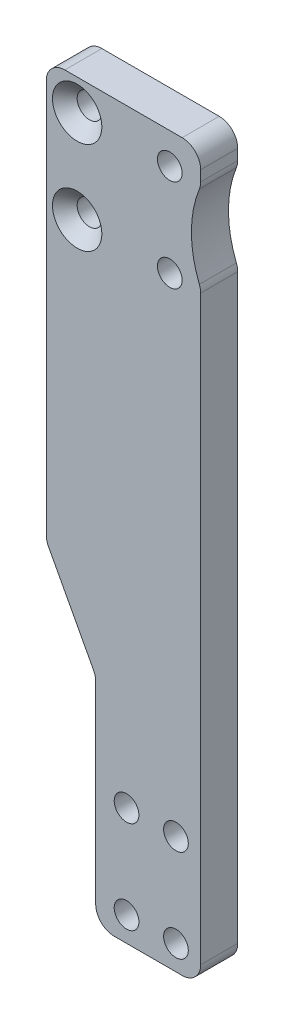
from build123d import *

# Parameters (mm, degrees)
SKETCH_1_R          = 2
EXTRUDE_1_DEPTH     = 6
SKETCH_2_R          = 18
CUT_EXTRUDE_1_DEPTH = 6
SKETCH_3_W          = 2
SKETCH_3_H          = 20
SKETCH_3_W_2        = 23
SKETCH_3_H_2        = 10
CUT_EXTRUDE_2_DEPTH = 10
CUT_EXTRUDE_3_DEPTH = 10
EXTRUDE_2_DEPTH     = 6
SKETCH_6_W          = 15.770181782
SKETCH_6_H          = 14.407317349
EXTRUDE_3_DEPTH     = 6
SKETCH_7_R          = 2
CUT_EXTRUDE_4_DEPTH = 10
FILLET_1_R          = 3
SKETCH_8_R          = 2
CUT_EXTRUDE_5_DEPTH = 10
SKETCH_9_W          = 8
SKETCH_9_H          = 35
CUT_EXTRUDE_6_DEPTH = 10
CUT_EXTRUDE_7_DEPTH = 10
FILLET_2_R          = 3
CHAMFER_1_SIZE      = 2


with BuildPart() as part:
    # 草图1 → 凸台-拉伸1 (new body)
    with BuildSketch(Plane.XY):
        Polygon((12.5, 15), (18, 87.5), (18, 112.5), (-7, 112.5), (-7, 87.5), (-10.5, 15), (-12.5, 15), (-12.5, -15), (12.5, -15), align=None)
        with Locations((7.5, -6)):
            Circle(SKETCH_1_R, mode=Mode.SUBTRACT)
        with Locations((13, 92.5)):
            Circle(SKETCH_1_R, mode=Mode.SUBTRACT)
        with Locations((13, 107.5)):
            Circle(SKETCH_1_R, mode=Mode.SUBTRACT)
        with Locations((-2, 107.5)):
            Circle(SKETCH_1_R, mode=Mode.SUBTRACT)
        with Locations((7.5, 6)):
            Circle(SKETCH_1_R, mode=Mode.SUBTRACT)
        with Locations((-2, 92.5)):
            Circle(SKETCH_1_R, mode=Mode.SUBTRACT)
        with Locations((-0.5, 6)):
            Circle(SKETCH_1_R, mode=Mode.SUBTRACT)
        with Locations((-0.5, -6)):
            Circle(SKETCH_1_R, mode=Mode.SUBTRACT)
    extrude(amount=EXTRUDE_1_DEPTH)

    # 草图2 → 切除-拉伸1 (cut)
    with BuildSketch(Plane.XY.offset(6)):
        with Locations((34.5, 100)):
            Circle(SKETCH_2_R)
    extrude(amount=-CUT_EXTRUDE_1_DEPTH, mode=Mode.SUBTRACT)

    # 草图3 → 切除-拉伸2 (cut)
    with BuildSketch(Plane.XY.offset(6)):
        with Locations((-11.5, 5)):
            Rectangle(SKETCH_3_W, SKETCH_3_H)
        with Locations((1, -10)):
            Rectangle(SKETCH_3_W_2, SKETCH_3_H_2)
        with Locations((-11.5, -10)):
            Rectangle(SKETCH_3_W, SKETCH_3_H_2)
    extrude(amount=-CUT_EXTRUDE_2_DEPTH, mode=Mode.SUBTRACT)

    # 草图4 → 切除-拉伸3 (cut)
    with BuildSketch(Plane.XY.offset(6)):
        Polygon((-7, -5), (-7, 87.5), (-10.5, 15), (-10.5, -5), align=None)
    extrude(amount=-CUT_EXTRUDE_3_DEPTH, mode=Mode.SUBTRACT)

    # 草图5 → 凸台-拉伸2 (add)
    with BuildSketch(Plane.XY.offset(6)):
        Polygon((18, 87.5), (18, -5), (12.5, -5), (12.5, 15), align=None)
    extrude(amount=-EXTRUDE_2_DEPTH)

    # 草图6 → 凸台-拉伸3 (add)
    with BuildSketch(Plane.XY.offset(6)):
        with Locations((3.826559257, 2.203658675)):
            Rectangle(SKETCH_6_W, SKETCH_6_H)
    extrude(amount=-EXTRUDE_3_DEPTH)

    # 草图7 → 切除-拉伸4 (cut)
    with BuildSketch(Plane.XY.offset(6)):
        with Locations((6, -1)):
            Circle(SKETCH_7_R)
        with Locations((6, 14)):
            Circle(SKETCH_7_R)
        with Locations((-2, 14)):
            Circle(SKETCH_7_R)
        with Locations((-2, -1)):
            Circle(SKETCH_7_R)
    extrude(amount=-CUT_EXTRUDE_4_DEPTH, mode=Mode.SUBTRACT)

    # 圆角1
    fillet_1_edges = [part.edges().sort_by_distance(p)[0] for p in [
        (-7, -5, 3),
        (18, -5, 3),
        (-7, 112.5, 3),
        (18, 112.5, 3),
        (18, 107.193747285, 3),
        (18, 92.806252715, 3),
    ]]
    fillet(fillet_1_edges, radius=FILLET_1_R)

    # 草图8 → 切除-拉伸5 (cut)
    with BuildSketch(Plane.XY.offset(6)):
        with Locations((14, 14)):
            Circle(SKETCH_8_R)
        with Locations((14, -1)):
            Circle(SKETCH_8_R)
    extrude(amount=-CUT_EXTRUDE_5_DEPTH, mode=Mode.SUBTRACT)

    # 草图9 → 切除-拉伸6 (cut)
    with BuildSketch(Plane.XY.offset(6)):
        with Locations((-3, 12.5)):
            Rectangle(SKETCH_9_W, SKETCH_9_H)
    extrude(amount=-CUT_EXTRUDE_6_DEPTH, mode=Mode.SUBTRACT)

    # 草图10 → 切除-拉伸7 (cut)
    with BuildSketch(Plane.XY.offset(6)):
        Polygon((1, 30), (-7, 30), (-7, 45), align=None)
    extrude(amount=-CUT_EXTRUDE_7_DEPTH, mode=Mode.SUBTRACT)

    # 圆角2
    fillet_2_edges = [part.edges().sort_by_distance(p)[0] for p in [
        (1, 30, 3),
        (1, -5, 3),
        (-7, 45, 3),
    ]]
    fillet(fillet_2_edges, radius=FILLET_2_R)

    # 倒角1
    chamfer_1_edges = [part.edges().sort_by_distance(p)[0] for p in [
        (-4, 92.5, 6),
        (-4, 107.5, 6),
    ]]
    chamfer(chamfer_1_edges, length=CHAMFER_1_SIZE)


solid = part.part
